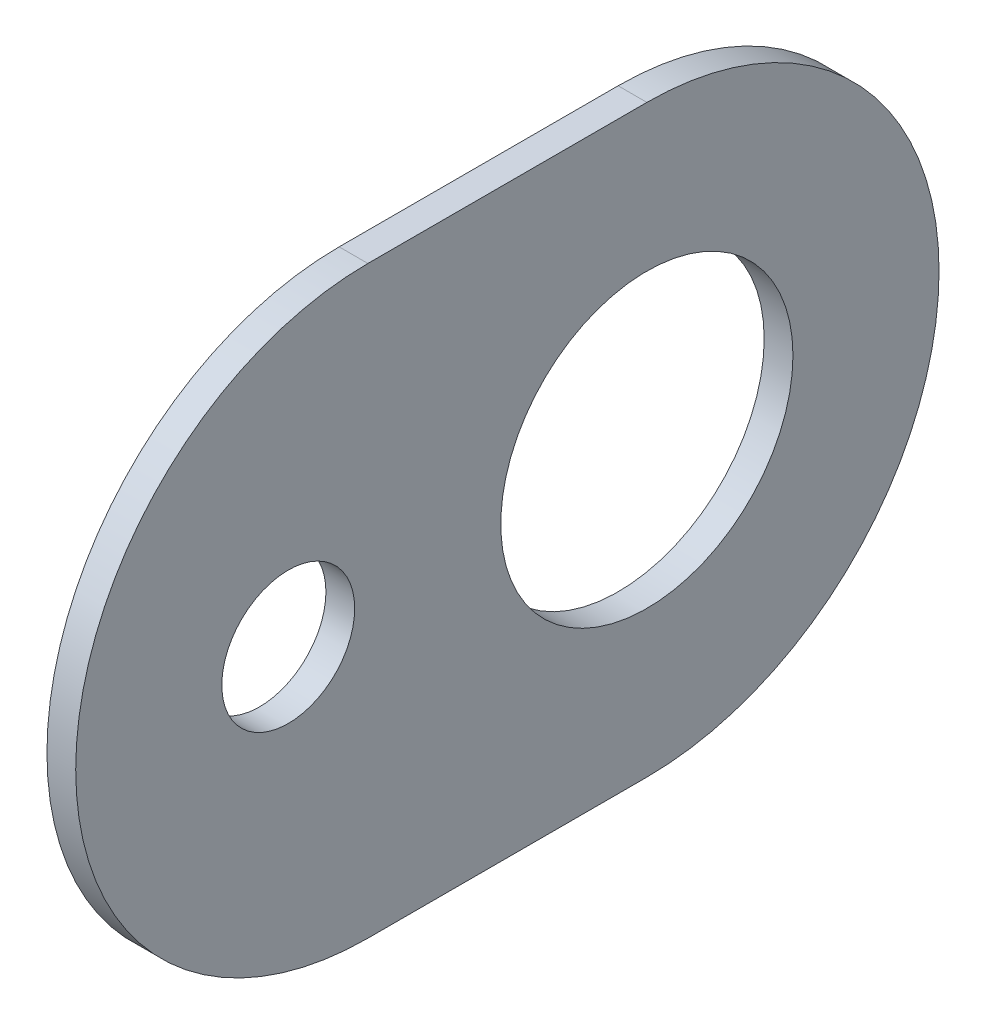
from build123d import *

# Parameters (mm, degrees)
SKETCH1_R           = 5.7759727
SKETCH1_R_2         = 12.7
BOSS_EXTRUDE1_DEPTH = 2.5


with BuildPart() as part:
    # Sketch1 → Boss-Extrude1 (new body)
    with BuildSketch(Plane.YZ):
        with BuildLine():
            Line((-25.399999937, -12.125972668), (-25.399999937, 12.125972668))
            ThreePointArc((-25.399999937, 12.125972668), (0, 37.525972605), (25.399999936, 12.125972668))
            Line((25.399999936, 12.125972668), (25.399999937, -12.125972668))
            ThreePointArc((25.399999937, -12.125972668), (0, -37.525972605), (-25.399999937, -12.125972668))
        make_face()
        with Locations(Location((0, 19.049999968, 0), (0, 0, 270))):
            Circle(SKETCH1_R, mode=Mode.SUBTRACT)
        with Locations(Location((0, -12.125972668, 0), (0, 0, 270))):
            Circle(SKETCH1_R_2, mode=Mode.SUBTRACT)
    extrude(amount=BOSS_EXTRUDE1_DEPTH)


solid = part.part
